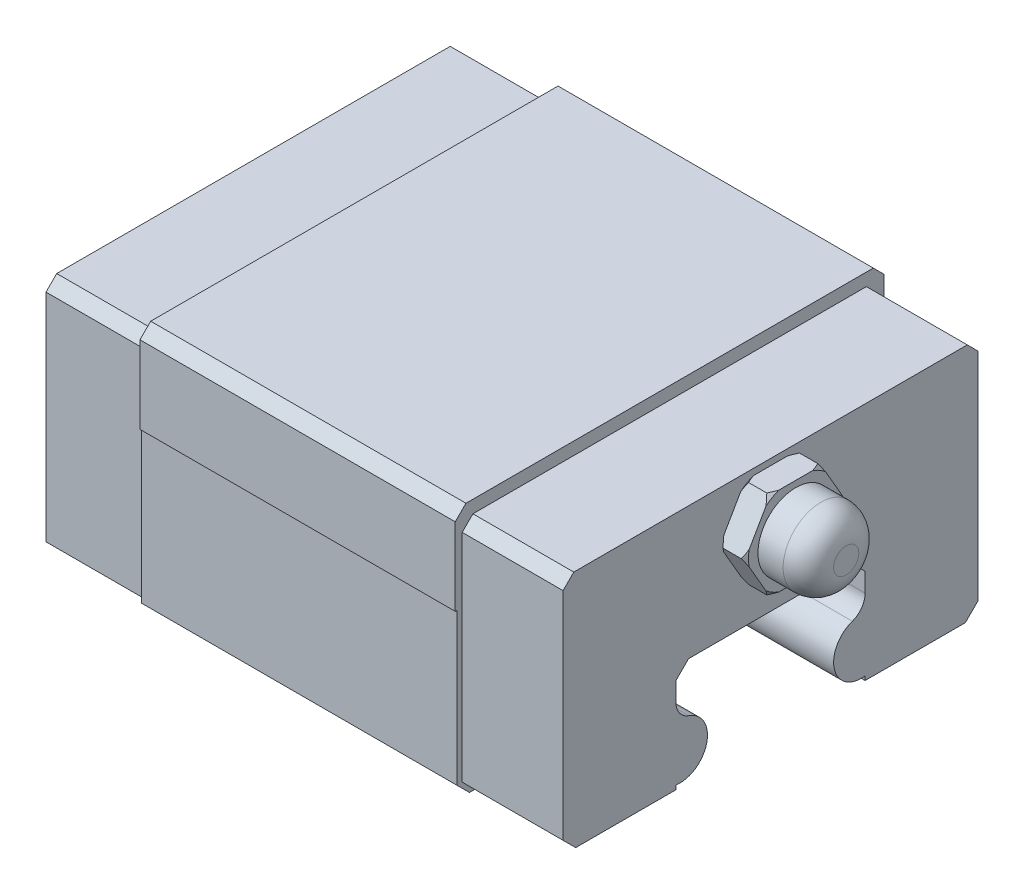
from build123d import *

# Parameters (mm, degrees)
SKETCH1_W           = 34
SKETCH1_H           = 20
BOSS_EXTRUDE1_DEPTH = 20.5
SKETCH2_OUTSIDE_W   = 47.378
SKETCH2_OUTSIDE_H   = 33.378
SKETCH2_OUTSIDE_W_2 = 32.9
SKETCH2_OUTSIDE_H_2 = 19
CUT_EXTRUDE2_DEPTH  = 45.204072211
CUT_EXTRUDE5_DEPTH  = 20.5
SKETCH3_W           = 0.125
SKETCH3_H           = 13
CUT_EXTRUDE3_DEPTH  = 25
CHAMFER1_SIZE       = 0.85
CHAMFER2_SIZE       = 0.85
CHAMFER3_SIZE       = 1
CHAMFER4_SIZE       = 1
BOSS_EXTRUDE2_DEPTH = 2
SKETCH10_R          = 3
BOSS_EXTRUDE3_DEPTH = 6
FILLET1_R           = 2
SCALE_1_SCALE       = 1.7


with BuildPart() as part:
    # Sketch1 → Boss-Extrude1 (new, symmetric)
    with BuildSketch(Plane(origin=(0, 0, 0), x_dir=(0, 0, -1), z_dir=(1, 0, 0))):
        with Locations((0, 14)):
            Rectangle(SKETCH1_W, SKETCH1_H)
    extrude(amount=BOSS_EXTRUDE1_DEPTH, both=True)

    # Sketch2 outside → Cut-Extrude2 (cut, through all)
    with BuildSketch(Plane(origin=(12.5, 0, 0), x_dir=(0, 0, -1), z_dir=(1, 0, 0))):
        with Locations((0, 14)):
            Rectangle(SKETCH2_OUTSIDE_W, SKETCH2_OUTSIDE_H)
        with Locations((0, 13.5)):
            Rectangle(SKETCH2_OUTSIDE_W_2, SKETCH2_OUTSIDE_H_2, mode=Mode.SUBTRACT)
    cut_extrude2 = extrude(amount=CUT_EXTRUDE2_DEPTH, mode=Mode.SUBTRACT)

    # Mirror1: Cut-Extrude2 across plane
    add(cut_extrude2.mirror(Plane(origin=(0, 0, 0), x_dir=(0, 0, 1), z_dir=(1, 0, 0))), mode=Mode.SUBTRACT)

    # Sketch5 → Cut-Extrude5 (cut, symmetric)
    with BuildSketch(Plane(origin=(0, 0, 0), x_dir=(0, 0, -1), z_dir=(1, 0, 0))):
        with BuildLine():
            Line((-6.5, 12.5), (-7.5, 11.5))
            Line((-7.5, 11.5), (-7.5, 10))
            ThreePointArc((-7.5, 10), (-7.220600207, 9.128142709), (-6.486486487, 8.581081081))
            ThreePointArc((-6.486486487, 8.581081081), (-5.059724667, 5.990862007), (-7.5, 4.320550528))
            Line((-7.5, 4.320550528), (-7.5, 0.5))
            Line((-7.5, 0.5), (-7, 0))
            Line((-7, 0), (7, 0))
            Line((7, 0), (7.5, 0.5))
            Line((7.5, 0.5), (7.5, 4.320550528))
            ThreePointArc((7.5, 4.320550528), (5.059724667, 5.990862007), (6.486486487, 8.581081081))
            ThreePointArc((6.486486487, 8.581081081), (7.220600207, 9.128142709), (7.5, 10))
            Line((7.5, 10), (7.5, 11.5))
            Line((7.5, 11.5), (6.5, 12.5))
            Line((6.5, 12.5), (-6.5, 12.5))
        make_face()
    extrude(amount=CUT_EXTRUDE5_DEPTH, both=True, mode=Mode.SUBTRACT)

    # Sketch3 → Cut-Extrude3 (cut)
    with BuildSketch(Plane(origin=(12.5, 0, 0), x_dir=(0, 0, -1), z_dir=(1, 0, 0))):
        with Locations((-16.9375, 10.5)):
            Rectangle(SKETCH3_W, SKETCH3_H)
    cut_extrude3 = extrude(amount=-CUT_EXTRUDE3_DEPTH, mode=Mode.SUBTRACT)

    # Mirror2: Cut-Extrude3 across plane
    add(cut_extrude3.mirror(Plane.XY), mode=Mode.SUBTRACT)

    # Chamfer1
    chamfer1_edges = [part.edges().sort_by_distance(p)[0] for p in [
        (-16.5, 23, 16.45),
        (-16.5, 23, -16.45),
        (16.5, 23, -16.45),
        (16.5, 23, 16.45),
    ]]
    chamfer(chamfer1_edges, length=CHAMFER1_SIZE)

    # Chamfer2
    chamfer2_edges = [part.edges().sort_by_distance(p)[0] for p in [
        (0, 24, -17),
        (0, 24, 17),
    ]]
    chamfer(chamfer2_edges, length=CHAMFER2_SIZE)

    # Chamfer3
    chamfer3_edges = [part.edges().sort_by_distance(p)[0] for p in [
        (-16.5, 4, -16.45),
        (16.5, 4, -16.45),
        (-16.5, 4, 16.45),
        (16.5, 4, 16.45),
    ]]
    chamfer(chamfer3_edges, length=CHAMFER3_SIZE)

    # Chamfer4
    chamfer4_edges = [part.edges().sort_by_distance(p)[0] for p in [
        (0, 4, -16.875),
        (0, 4, 16.875),
    ]]
    chamfer(chamfer4_edges, length=CHAMFER4_SIZE)

    # Sketch7 → Boss-Extrude2 (add)
    with BuildSketch(Plane(origin=(20.5, 0, 0), x_dir=(0, 0, -1), z_dir=(1, 0, 0))):
        Polygon((-2.020725942, 15.5), (2.020725942, 15.5), (4.041451884, 19), (2.020725942, 22.5), (-2.020725942, 22.5), (-4.041451884, 19), align=None)
    extrude(amount=BOSS_EXTRUDE2_DEPTH)

    # Sketch9 → Cut-Revolve1 (revolve, cut)
    with BuildSketch(Plane.XY):
        Polygon((22.5, 22.75), (21.5, 23.803780125), (20.5, 22.75), (20.5, 24), (22.5, 24), align=None)
    revolve(axis=Axis((20.5, 19, 0), (1, 0, 0)), mode=Mode.SUBTRACT)

    # Sketch10 → Boss-Extrude3 (add)
    with BuildSketch(Plane(origin=(20.5, 0, 0), x_dir=(0, 0, -1), z_dir=(1, 0, 0))):
        with Locations((0, 19)):
            Circle(SKETCH10_R)
    extrude(amount=BOSS_EXTRUDE3_DEPTH)

    # Fillet1
    fillet1_edges = [part.edges().sort_by_distance(p)[0] for p in [
        (26.5, 19, 3),
    ]]
    fillet(fillet1_edges, radius=FILLET1_R)


with BuildPart() as part_1:
    # 缩放比例1: scaled about (0, 0, 0)
    add(part.part.scale(SCALE_1_SCALE))


solid = part_1.part
